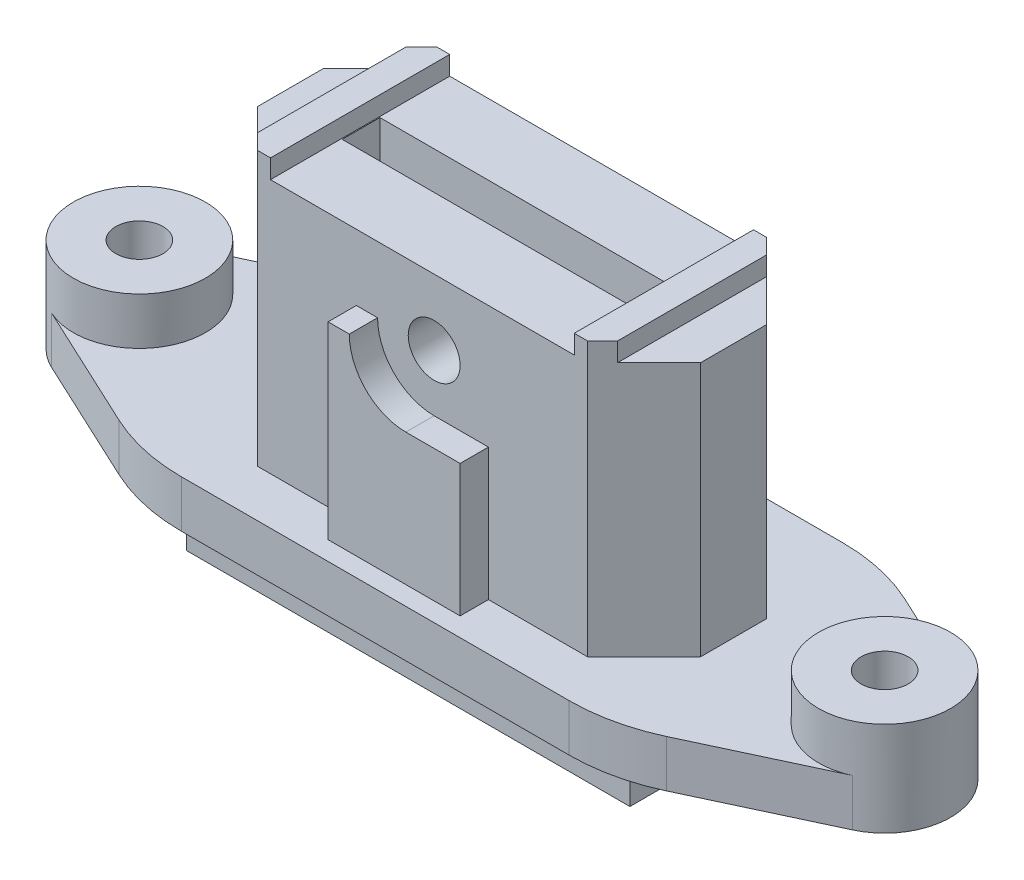
from build123d import *

# Parameters (mm, degrees)
SKETCH1_W               = 23.5
SKETCH1_H               = 11
BOSS_EXTRUDE1_DEPTH     = 2.5
BOSS_EXTRUDE2_DEPTH     = 2.5
BOSS_EXTRUDE3_DEPTH     = 13.5
BOSS_EXTRUDE4_DEPTH     = 1
CUT_EXTRUDE1_DEPTH      = 12
SKETCH7_W               = 16
SKETCH7_H               = 2
CUT_EXTRUDE2_DEPTH      = 32.198958316
SKETCH8_R               = 1.375
CUT_EXTRUDE3_DEPTH      = 12
CUT_EXTRUDE5_DEPTH      = 1.5
SKETCH10_R              = 3.5
BOSS_EXTRUDE5_DEPTH     = 2.5
CUT_EXTRUDE6_DEPTH      = 29.34387059
CUT_EXTRUDE6_DEPTH_BACK = 29.34387059
SKETCH11_R              = 1.25


with BuildPart() as part:
    # Sketch1 → Boss-Extrude1 (new body)
    with BuildSketch(Plane(origin=(0, 0, 0), x_dir=(1, 0, 0), z_dir=(0, 1, 0))):
        Rectangle(SKETCH1_W, SKETCH1_H)
    extrude(amount=BOSS_EXTRUDE1_DEPTH)

    # Sketch2 → Boss-Extrude2 (add)
    with BuildSketch(Plane(origin=(0, 2.5, 0), x_dir=(1, 0, 0), z_dir=(0, 1, 0))):
        with BuildLine():
            Line((21.231385291, -3.171040463), (14.511908348, -6.310115609))
            ThreePointArc((14.511908348, -6.310115609), (12.447193964, -7.012201496), (10.279378945, -7.25))
            Line((10.279378945, -7.25), (-10.279378945, -7.25))
            ThreePointArc((-10.279378945, -7.25), (-12.447193964, -7.012201496), (-14.511908348, -6.310115609))
            Line((-14.511908348, -6.310115609), (-21.231385291, -3.171040463))
            ThreePointArc((-21.231385291, -3.171040463), (-23.25, 0), (-21.231385291, 3.171040463))
            Line((-21.231385291, 3.171040463), (-14.511908348, 6.310115609))
            ThreePointArc((-14.511908348, 6.310115609), (-12.447193964, 7.012201496), (-10.279378945, 7.25))
            Line((-10.279378945, 7.25), (10.279378945, 7.25))
            ThreePointArc((10.279378945, 7.25), (12.447193964, 7.012201496), (14.511908348, 6.310115609))
            Line((14.511908348, 6.310115609), (21.231385291, 3.171040463))
            ThreePointArc((21.231385291, 3.171040463), (23.25, 0), (21.231385291, -3.171040463))
        make_face()
    extrude(amount=BOSS_EXTRUDE2_DEPTH)

    # Sketch3 → Boss-Extrude3 (add)
    with BuildSketch(Plane(origin=(0, 5, 0), x_dir=(1, 0, 0), z_dir=(0, 1, 0))):
        Polygon((8.75, -4.75), (3.5, -4.75), (3.5, -6.25), (-3.5, -6.25), (-3.5, -4.75), (-8.75, -4.75), (-11.75, -1.75), (-11.75, 1.75), (-8.75, 4.75), (8.75, 4.75), (11.75, 1.75), (11.75, -1.75), align=None)
    extrude(amount=BOSS_EXTRUDE3_DEPTH)

    # Sketch5 → Boss-Extrude4 (add)
    with BuildSketch(Plane(origin=(0, 18.5, 0), x_dir=(1, 0, 0), z_dir=(0, 1, 0))):
        Polygon((8.75, 4.75), (8.05, 4.75), (8.05, -4.75), (8.75, -4.75), (9.55, -3.95), (9.55, 3.95), align=None)
        Polygon((-8.05, 4.75), (-8.75, 4.75), (-9.55, 3.95), (-9.55, -3.95), (-8.75, -4.75), (-8.05, -4.75), align=None)
    extrude(amount=BOSS_EXTRUDE4_DEPTH)

    # Sketch6 → Cut-Extrude1 (cut)
    with BuildSketch(Plane(origin=(0, 0, 0), x_dir=(1, 0, 0), z_dir=(0, 1, 0))):
        Polygon((8.4, 3.45), (5.1, 3.45), (4.6, 2.95), (4.1, 2.95), (3.6, 3.45), (-3.6, 3.45), (-4.1, 2.95), (-4.6, 2.95), (-5.1, 3.45), (-8.4, 3.45), (-10.35, 1.5), (-10.35, -1.5), (-8.4, -3.45), (-2.05, -3.45), (-2.05, -4.55), (2.05, -4.55), (2.05, -3.45), (8.4, -3.45), (10.35, -1.5), (10.35, 1.5), align=None)
    extrude(amount=CUT_EXTRUDE1_DEPTH, mode=Mode.SUBTRACT)

    # Sketch7 → Cut-Extrude2 (cut, through all)
    with BuildSketch(Plane(origin=(0, 0, 0), x_dir=(1, 0, 0), z_dir=(0, 1, 0))):
        Rectangle(SKETCH7_W, SKETCH7_H)
    extrude(amount=CUT_EXTRUDE2_DEPTH, mode=Mode.SUBTRACT)

    # Sketch8 → Cut-Extrude3 (cut)
    with BuildSketch(Plane.XY.offset(6.25)):
        with Locations((0.625, 15)):
            Circle(SKETCH8_R)
    extrude(amount=-CUT_EXTRUDE3_DEPTH, mode=Mode.SUBTRACT)

    # Sketch9 → Cut-Extrude5 (cut)
    with BuildSketch(Plane.XY.offset(6.25)):
        with BuildLine():
            Line((0.625, 12), (3.5, 12))
            Line((3.5, 12), (3.5, 18.5))
            Line((3.5, 18.5), (-3.5, 18.5))
            Line((-3.5, 18.5), (-3.5, 15))
            Line((-3.5, 15), (-2.375, 15))
            ThreePointArc((-2.375, 15), (-1.496320344, 12.878679656), (0.625, 12))
        make_face()
    extrude(amount=-CUT_EXTRUDE5_DEPTH, mode=Mode.SUBTRACT)

    # Sketch10 → Boss-Extrude5 (add)
    with BuildSketch(Plane(origin=(0, 5, 0), x_dir=(1, 0, 0), z_dir=(0, 1, 0))):
        with Locations(Location((-19.75, 0, 0), (0, 0, 115.040130233))):
            Circle(SKETCH10_R)
        with Locations(Location((19.75, 0, 0), (0, 0, 64.959869767))):
            Circle(SKETCH10_R)
    extrude(amount=BOSS_EXTRUDE5_DEPTH)

    # Sketch11 → Cut-Extrude6 (cut, two sides: drawn at the far end of the back side and taken through both)
    with BuildSketch(Plane(origin=(0, 5, 0), x_dir=(1, 0, 0), z_dir=(0, 1, 0)).offset(-CUT_EXTRUDE6_DEPTH_BACK)):
        with Locations(Location((19.75, 0, 0), (0, 0, 270))):
            Circle(SKETCH11_R)
        with Locations(Location((-19.75, 0, 0), (0, 0, 270))):
            Circle(SKETCH11_R)
    extrude(amount=CUT_EXTRUDE6_DEPTH + CUT_EXTRUDE6_DEPTH_BACK, mode=Mode.SUBTRACT)


solid = part.part
